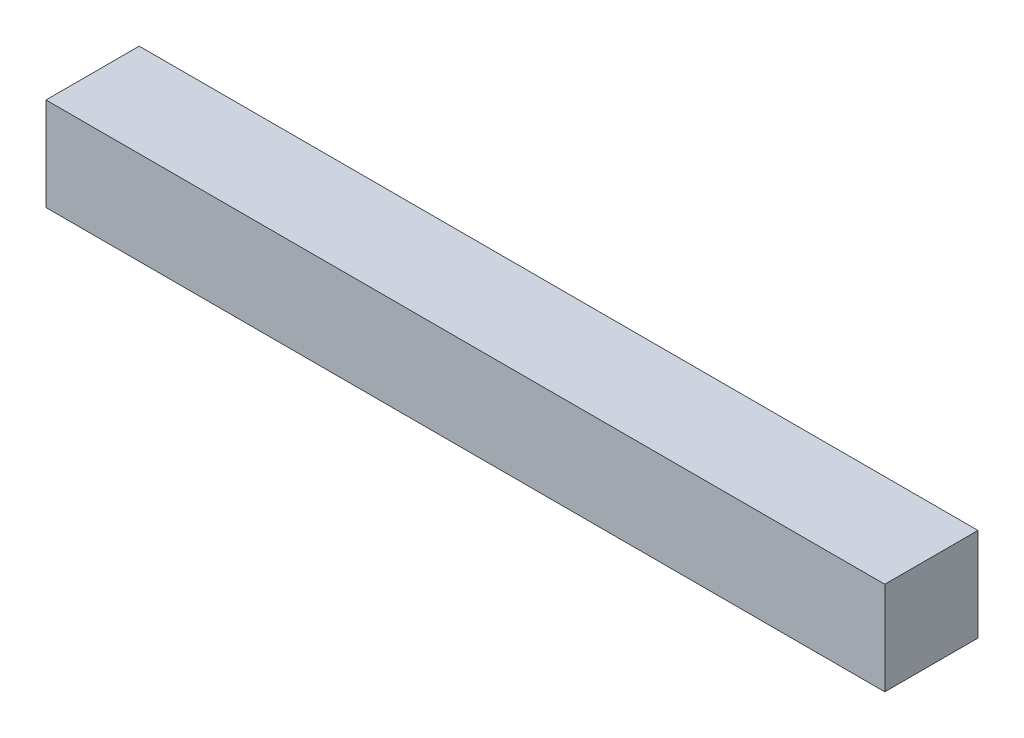
from build123d import *

# Parameters (mm, degrees)
SKETCH4_W           = 114.3
SKETCH4_H           = 12.7
BOSS_EXTRUDE1_DEPTH = 12.7
SHELL4_T            = -2.54


with BuildPart() as part:
    # Sketch4 → Boss-Extrude1 (new body)
    with BuildSketch(Plane.XY):
        with Locations((107.264583379, 17.738132345)):
            Rectangle(SKETCH4_W, SKETCH4_H)
    extrude(amount=BOSS_EXTRUDE1_DEPTH)

    # Shell4
    shell4_openings = [part.faces().sort_by_distance(p)[0] for p in [
        (107.264583379, 11.388132345, 6.35),
    ]]
    offset(amount=SHELL4_T, openings=shell4_openings, kind=Kind.INTERSECTION)


solid = part.part
